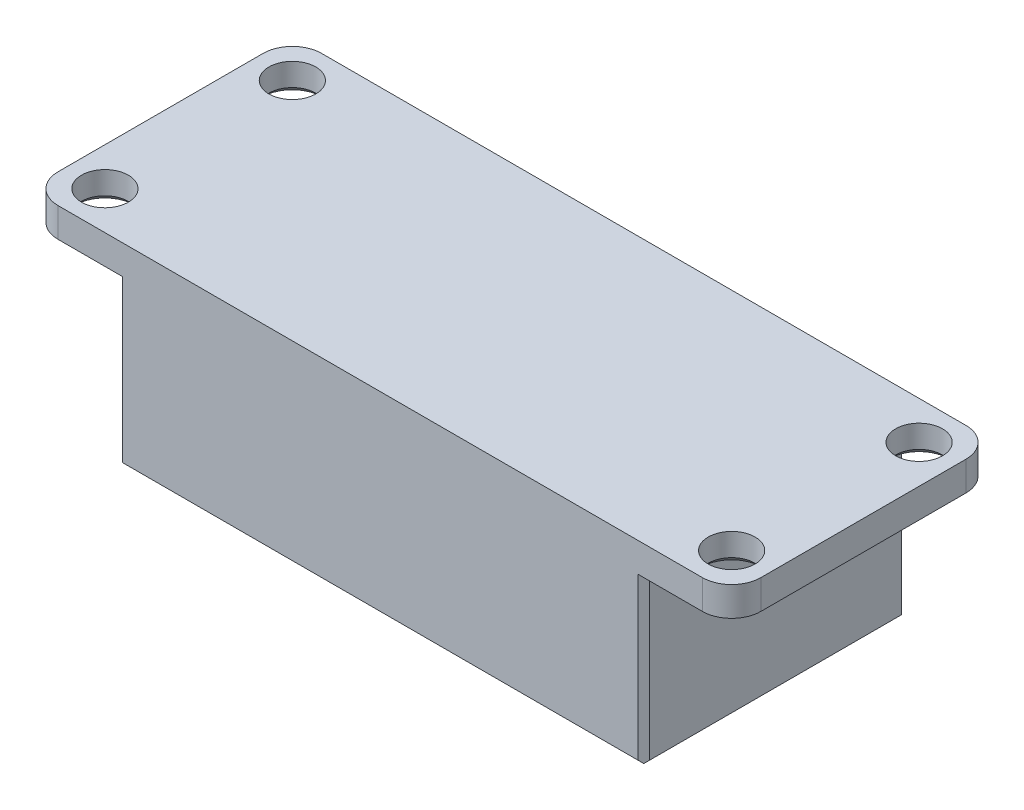
from build123d import *

# Parameters (mm, degrees)
SKETCH_1_W                  = 18
SKETCH_1_H                  = 9
EXTRUDE_1_DEPTH             = 6
SKETCH_2_W                  = 24
SKETCH_2_H                  = 9
EXTRUDE_2_DEPTH             = 1
FILLET_1_R                  = 1
CHAMFER_1_SIZE              = 0.5
CHAMFER_2_SIZE              = 0.2
HOLE_WIZARD_M2_1_AT_2_COUNT = 2
HOLE_WIZARD_M2_1_AT_2_PITCH = 6.4
HOLE_WIZARD_M2_1_AT_3_COUNT = 2
HOLE_WIZARD_M2_1_AT_3_PITCH = 22.336517186
HOLE_WIZARD_M2_1_AT_4_COUNT = 2
HOLE_WIZARD_M2_1_AT_4_PITCH = 21.4


with BuildPart() as part:
    # 草图1 → 凸台-拉伸1 (new body)
    with BuildSketch(Plane(origin=(0, 0, 0), x_dir=(1, 0, 0), z_dir=(0, 1, 0))):
        Rectangle(SKETCH_1_W, SKETCH_1_H)
    extrude(amount=EXTRUDE_1_DEPTH)

    # 草图2 → 凸台-拉伸2 (add)
    with BuildSketch(Plane(origin=(0, 6, 0), x_dir=(1, 0, 0), z_dir=(0, 1, 0))):
        Rectangle(SKETCH_2_W, SKETCH_2_H)
    extrude(amount=EXTRUDE_2_DEPTH)

    # 圆角1
    fillet_1_edges = [part.edges().sort_by_distance(p)[0] for p in [
        (-12, 6.5, -4.5),
        (-12, 6.5, 4.5),
        (12, 6.5, 4.5),
        (12, 6.5, -4.5),
    ]]
    fillet(fillet_1_edges, radius=FILLET_1_R)

    # 倒角1
    chamfer_1_edges = [part.edges().sort_by_distance(p)[0] for p in [
        (0, 0, -4.5),
        (9, 0, 0),
        (0, 0, 4.5),
        (-9, 0, 0),
    ]]
    chamfer(chamfer_1_edges, length=CHAMFER_1_SIZE)

    # 倒角2
    chamfer_2_edges = [part.edges().sort_by_distance(p)[0] for p in [
        (-9, 3.25, -4.5),
        (9, 3.25, -4.5),
        (9, 3.25, 4.5),
        (-9, 3.25, 4.5),
    ]]
    chamfer(chamfer_2_edges, length=CHAMFER_2_SIZE)

    # 草图5 → M2 螺纹孔1 (revolve, cut)
    with BuildSketch(Plane(origin=(-10.7, 6, -3.2), x_dir=(0, 0, -1), z_dir=(1, 0, 0))):
        Polygon((0, 0), (0, 1), (0.8, 1), (0.8, 0.225), (1.025, 0), align=None)
    hole_wizard_m2_1 = revolve(axis=Axis((-10.7, -0.35, -3.2), (0, 1, 0)), mode=Mode.SUBTRACT)

    # M2 螺纹孔1 at 2: M2 螺纹孔1 ×2
    with Locations(*[(0, 0, i * HOLE_WIZARD_M2_1_AT_2_PITCH) for i in range(1, HOLE_WIZARD_M2_1_AT_2_COUNT)]):
        add(hole_wizard_m2_1, mode=Mode.SUBTRACT)

    # M2 螺纹孔1 at 3: M2 螺纹孔1 ×2
    with Locations(*[Vector(0.958072371883615, 0, 0.2865263168250065) * (i * HOLE_WIZARD_M2_1_AT_3_PITCH) for i in range(1, HOLE_WIZARD_M2_1_AT_3_COUNT)]):
        add(hole_wizard_m2_1, mode=Mode.SUBTRACT)

    # M2 螺纹孔1 at 4: M2 螺纹孔1 ×2
    with Locations(*[(i * HOLE_WIZARD_M2_1_AT_4_PITCH, 0, 0) for i in range(1, HOLE_WIZARD_M2_1_AT_4_COUNT)]):
        add(hole_wizard_m2_1, mode=Mode.SUBTRACT)


solid = part.part
